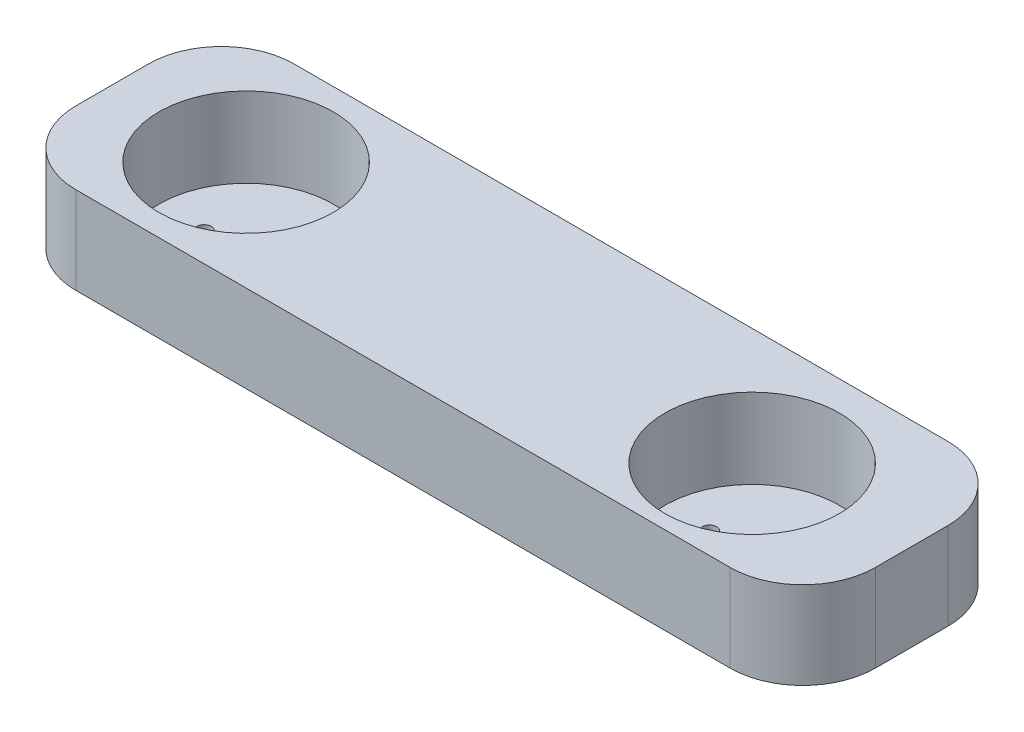
from build123d import *

# Parameters (mm, degrees)
SKETCH1_W           = 110
SKETCH1_H           = 30
BOSS_EXTRUDE1_DEPTH = 12
FILLET1_R           = 10
FILLET2_R           = 10
SKETCH9_R           = 12
CUT_EXTRUDE5_DEPTH  = 11
SKETCH13_R          = 12
CUT_EXTRUDE7_DEPTH  = 11
SKETCH15_R          = 3.43
SKETCH15_R_2        = 1
CUT_EXTRUDE8_DEPTH  = 123.394479271
SKETCH16_R          = 3.43
SKETCH16_R_2        = 1
CUT_EXTRUDE9_DEPTH  = 123.394479271


with BuildPart() as part:
    # Sketch1 → Boss-Extrude1 (new body)
    with BuildSketch(Plane(origin=(0, 0, 0), x_dir=(1, 0, 0), z_dir=(0, 1, 0))):
        with Locations((5.385430756, 3.53837453)):
            Rectangle(SKETCH1_W, SKETCH1_H)
    extrude(amount=BOSS_EXTRUDE1_DEPTH)

    # Fillet1
    fillet1_edges = [part.edges().sort_by_distance(p)[0] for p in [
        (-49.614569244, 6, -18.53837453),
        (-49.614569244, 6, 11.46162547),
    ]]
    fillet(fillet1_edges, radius=FILLET1_R)

    # Fillet2
    fillet2_edges = [part.edges().sort_by_distance(p)[0] for p in [
        (60.385430756, 6, -18.53837453),
        (60.385430756, 6, 11.46162547),
    ]]
    fillet(fillet2_edges, radius=FILLET2_R)

    # Sketch9 → Cut-Extrude5 (cut)
    with BuildSketch(Plane(origin=(0, 12, 0), x_dir=(1, 0, 0), z_dir=(0, 1, 0))):
        with Locations(Location((-31.195762423, 3.53837453, 0), (0, 0, 270))):
            Circle(SKETCH9_R)
    extrude(amount=-CUT_EXTRUDE5_DEPTH, mode=Mode.SUBTRACT)

    # Sketch13 → Cut-Extrude7 (cut)
    with BuildSketch(Plane(origin=(70.696833098, 12, 1.072209922), x_dir=(1, 0, 0), z_dir=(0, 1, 0))):
        with Locations(Location((-31.195762423, 3.53837453, 0), (0, 0, 270))):
            Circle(SKETCH13_R)
    extrude(amount=-CUT_EXTRUDE7_DEPTH, mode=Mode.SUBTRACT)

    # Sketch15 → Cut-Extrude8 (cut, through all)
    with BuildSketch(Plane(origin=(70.696833098, 1, 1.072209922), x_dir=(1, 0, 0), z_dir=(0, 1, 0))):
        with Locations(Location((-31.147671482, 3.53837453, 0), (0, 0, 270))):
            Circle(SKETCH15_R)
        with Locations(Location((-25.217671482, 3.53837453, 0), (0, 0, 270))):
            Circle(SKETCH15_R_2)
        with Locations(Location((-37.077671482, 3.53837453, 0), (0, 0, 90))):
            Circle(SKETCH15_R_2)
    extrude(amount=-CUT_EXTRUDE8_DEPTH, mode=Mode.SUBTRACT)

    # Sketch16 → Cut-Extrude9 (cut, through all)
    with BuildSketch(Plane(origin=(70.696833098, 1, 1.072209922), x_dir=(1, 0, 0), z_dir=(0, 1, 0))):
        with Locations(Location((-101.699594536, 4.556727145, 0), (0, 0, 270))):
            Circle(SKETCH16_R)
        with Locations(Location((-95.769594536, 4.556727145, 0), (0, 0, 270))):
            Circle(SKETCH16_R_2)
        with Locations(Location((-107.629594536, 4.556727145, 0), (0, 0, 90))):
            Circle(SKETCH16_R_2)
    extrude(amount=-CUT_EXTRUDE9_DEPTH, mode=Mode.SUBTRACT)


solid = part.part
